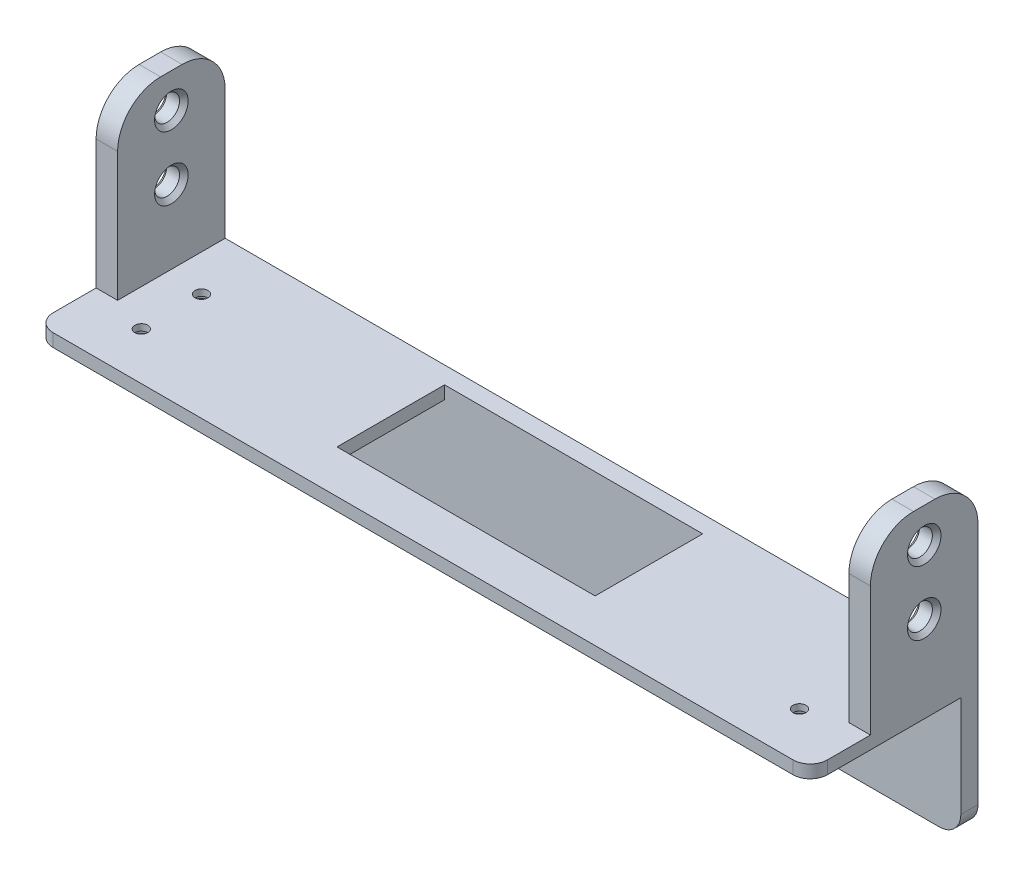
from build123d import *

# Parameters (mm, degrees)
SKETCH_1_W               = 180
SKETCH_1_H               = 60
EXTRUDE_1_DEPTH          = 4
SKETCH_2_W               = 180
SKETCH_2_H               = 3
EXTRUDE_2_DEPTH          = 35
SKETCH_3_R               = 1.5
CUT_EXTRUDE_1_DEPTH      = 50
FILLET_3_R               = 4
SKETCH_6_R               = 3
CUT_EXTRUDE_4_DEPTH      = 1.5
SKETCH_7_W               = 60
SKETCH_7_H               = 25
CUT_EXTRUDE_5_DEPTH      = 10
CUT_EXTRUDE_6_DEPTH      = 102.118742081
CUT_EXTRUDE_6_DEPTH_BACK = 102.118742081
SKETCH_8_W               = 180
SKETCH_8_H               = 28.5
SKETCH_9_W               = 25
SKETCH_9_H               = 40
EXTRUDE_3_DEPTH          = 5
CUT_EXTRUDE_7_DEPTH      = 189.794200123
CUT_EXTRUDE_7_DEPTH_BACK = 189.794200123
SKETCH_10_R              = 2.9
CHAMFER_2_SIZE           = 1
FILLET_4_R               = 5
CHAMFER_3_SIZE           = 1
FILLET_5_R               = 10
CHAMFER_4_SIZE           = 1


with BuildPart() as part:
    # 草图1 → 凸台-拉伸1 (new body)
    with BuildSketch(Plane.XY):
        Rectangle(SKETCH_1_W, SKETCH_1_H)
    extrude(amount=EXTRUDE_1_DEPTH)

    # 草图2 → 凸台-拉伸2 (add)
    with BuildSketch(Plane.XY.offset(4)):
        Rectangle(SKETCH_2_W, SKETCH_2_H)
    extrude(amount=EXTRUDE_2_DEPTH)

    # 草图3 → 切除-拉伸1 (cut)
    with BuildSketch(Plane.XZ.offset(1.5)):
        with Locations((-76.5, 28)):
            Circle(SKETCH_3_R)
        with Locations((-76.5, 14)):
            Circle(SKETCH_3_R)
        with Locations((76.5, 28)):
            Circle(SKETCH_3_R)
        with Locations((76.5, 14)):
            Circle(SKETCH_3_R)
    extrude(amount=-CUT_EXTRUDE_1_DEPTH, mode=Mode.SUBTRACT)

    # 圆角3
    fillet_3_edges = [part.edges().sort_by_distance(p)[0] for p in [
        (-90, 0, 39),
        (90, 0, 39),
    ]]
    fillet(fillet_3_edges, radius=FILLET_3_R)

    # 草图6 → 切除-拉伸4 (cut)
    with BuildSketch(Plane.XZ.offset(1.5)):
        with Locations((-76.5, 28)):
            Circle(SKETCH_6_R)
        with Locations((-76.5, 14)):
            Circle(SKETCH_6_R)
        with Locations((76.5, 28)):
            Circle(SKETCH_6_R)
        with Locations((76.5, 14)):
            Circle(SKETCH_6_R)
    extrude(amount=-CUT_EXTRUDE_4_DEPTH, mode=Mode.SUBTRACT)

    # 草图7 → 切除-拉伸5 (cut)
    with BuildSketch(Plane(origin=(0, 1.5, 0), x_dir=(1, 0, 0), z_dir=(0, 1, 0))):
        with Locations((0, -16.5)):
            Rectangle(SKETCH_7_W, SKETCH_7_H)
    extrude(amount=-CUT_EXTRUDE_5_DEPTH, mode=Mode.SUBTRACT)

    # 草图8 → 切除-拉伸6 (cut, two sides: drawn at the far end of the back side and taken through both)
    with BuildSketch(Plane.XY.offset(4).offset(-CUT_EXTRUDE_6_DEPTH_BACK)):
        with Locations((0, 15.75)):
            Rectangle(SKETCH_8_W, SKETCH_8_H)
    extrude(amount=CUT_EXTRUDE_6_DEPTH + CUT_EXTRUDE_6_DEPTH_BACK, mode=Mode.SUBTRACT)

    # 草图9 → 凸台-拉伸3 (add)
    with BuildSketch(Plane(origin=(90, 0, 0), x_dir=(0, 0, -1), z_dir=(1, 0, 0))):
        with Locations((-12.5, 21.5)):
            Rectangle(SKETCH_9_W, SKETCH_9_H)
    extrude_3 = extrude(amount=-EXTRUDE_3_DEPTH)

    # 镜向1: 凸台-拉伸3 across plane
    add(extrude_3.mirror(Plane(origin=(0, 0, 0), x_dir=(0, 0, 1), z_dir=(1, 0, 0))))

    # 草图10 → 切除-拉伸7 (cut, two sides: drawn at the far end of the back side and taken through both)
    with BuildSketch(Plane(origin=(90, 0, 0), x_dir=(0, 0, -1), z_dir=(1, 0, 0)).offset(-CUT_EXTRUDE_7_DEPTH_BACK)):
        with Locations(Location((-12.5, 33.5, 0), (0, 0, 90))):
            Circle(SKETCH_10_R)
        with Locations(Location((-12.5, 18.6, 0), (0, 0, 90))):
            Circle(SKETCH_10_R)
    extrude(amount=CUT_EXTRUDE_7_DEPTH + CUT_EXTRUDE_7_DEPTH_BACK, mode=Mode.SUBTRACT)

    # 倒角2
    chamfer_2_edges = [part.edges().sort_by_distance(p)[0] for p in [
        (85, 30.6, 12.5),
        (90, 30.6, 12.5),
        (-90, 30.6, 12.5),
        (-85, 30.6, 12.5),
    ]]
    chamfer(chamfer_2_edges, length=CHAMFER_2_SIZE)

    # 圆角4
    fillet_4_edges = [part.edges().sort_by_distance(p)[0] for p in [
        (90, -30, 2),
        (-90, -30, 2),
    ]]
    fillet(fillet_4_edges, radius=FILLET_4_R)

    # 倒角3
    chamfer_3_edges = [part.edges().sort_by_distance(p)[0] for p in [
        (90, 15.7, 12.5),
        (-90, 15.7, 12.5),
    ]]
    chamfer(chamfer_3_edges, length=CHAMFER_3_SIZE)

    # 圆角5
    fillet_5_edges = [part.edges().sort_by_distance(p)[0] for p in [
        (87.5, 41.5, 0),
        (87.5, 41.5, 25),
        (-87.5, 41.5, 0),
        (-87.5, 41.5, 25),
    ]]
    fillet(fillet_5_edges, radius=FILLET_5_R)

    # 倒角4
    chamfer_4_edges = [part.edges().sort_by_distance(p)[0] for p in [
        (85, 15.7, 12.5),
        (-85, 15.7, 12.5),
    ]]
    chamfer(chamfer_4_edges, length=CHAMFER_4_SIZE)


solid = part.part
